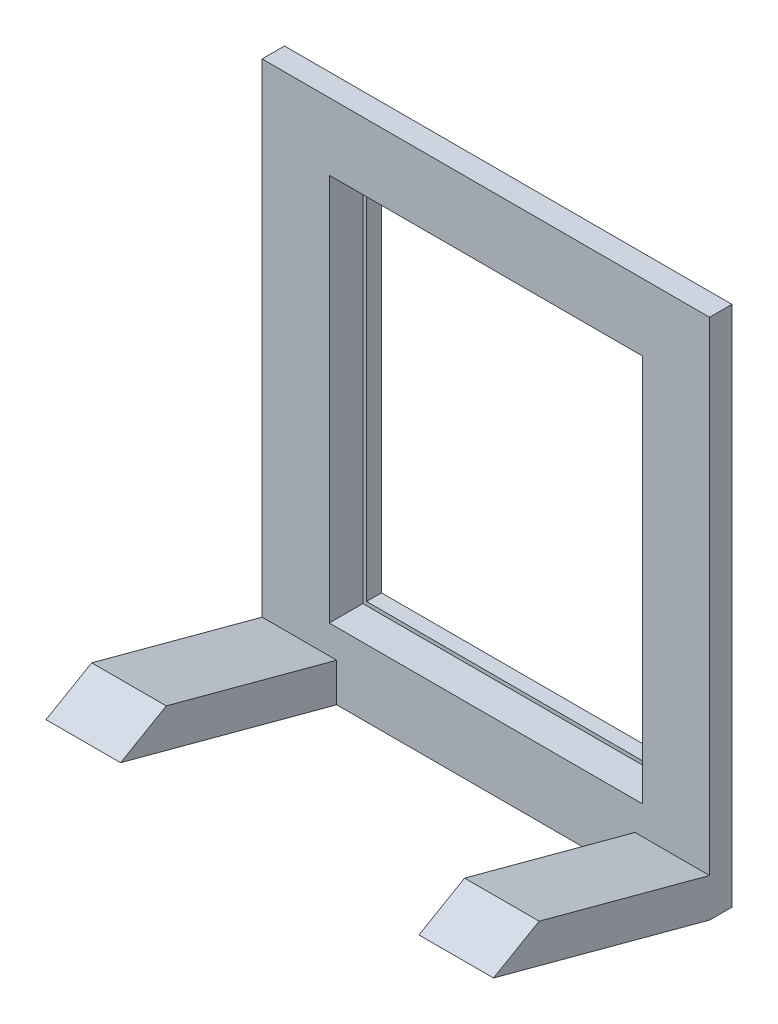
from build123d import *

# Parameters (mm, degrees)
EXTRUDE_1_DEPTH      = 4.5
EXTRUDE_1_DEPTH_BACK = 2
SKETCH_1_W           = 60
SKETCH_1_H           = 70
SKETCH_1_W_2         = 41
SKETCH_1_H_2         = 51
SKETCH_2_W           = 42
SKETCH_2_H           = 52
CUT_EXTRUDE_2_DEPTH  = 47.316843588
EXTRUDE_2_DEPTH      = 10


with BuildPart() as part:
    # Эскиз1 → Бобышка-Вытянуть1 (new, two sides: drawn at the far end of the back side and taken through both)
    with BuildSketch(Plane.XY.offset(-EXTRUDE_1_DEPTH_BACK)):
        Rectangle(SKETCH_1_W, SKETCH_1_H)
        Rectangle(SKETCH_1_W_2, SKETCH_1_H_2, mode=Mode.SUBTRACT)
    extrude(amount=EXTRUDE_1_DEPTH + EXTRUDE_1_DEPTH_BACK)

    # Эскиз2 → Вырез-Вытянуть2 (cut, through all)
    with BuildSketch(Plane(origin=(0, 0, 0), x_dir=(-1, 0, 0), z_dir=(0, 0, -1))):
        Rectangle(SKETCH_2_W, SKETCH_2_H)
    extrude(amount=-CUT_EXTRUDE_2_DEPTH, mode=Mode.SUBTRACT)

    # Вырез-По траектории1: sweep along a path in Эскиз4
    with BuildLine(Plane(origin=(0, 0, -2), x_dir=(-1, 0, 0), z_dir=(0, 0, -1))) as sweep_1_path:
        Line((-30, 35), (-30, -35))
        Line((-30, -35), (30, -35))
        Line((30, -35), (30, 35))
        Line((30, 35), (-30, 35))
    # Эскиз3 → Вырез-По траектории1 (sweep, cut)
    with BuildSketch(Plane(origin=(0, -35, 0), x_dir=(-1, 0, 0), z_dir=(0, -1, 0))):
        with BuildLine():
            Line((-30, 2), (-30, -1.5))
            Line((-30, -1.5), (-28.5, -1.5))
            Line((-28.5, -1.5), (-28.5, -2.5))
            Line((-28.5, -2.5), (-27, -2.5))
            Line((-27, -2.5), (-27, -2))
            ThreePointArc((-27, -2), (-25.297684645, 0.454165972), (-22.5, 1.5))
            Line((-22.5, 1.5), (-22, 1.5))
            Line((-22, 1.5), (-22, 2))
            Line((-22, 2), (-30, 2))
        make_face()
    sweep(path=sweep_1_path.line, transition=Transition.RIGHT, mode=Mode.SUBTRACT)

    # Эскиз5 → Бобышка-Вытянуть2 (add)
    with BuildSketch(Plane(origin=(30, 0, 0), x_dir=(0, 0, -1), z_dir=(1, 0, 0))):
        Polygon((-33.477774789, -27.235428647), (-4.5, -35), (-4.5, -29.823619098), (-27.354050432, -23.699894741), align=None)
    extrude_2 = extrude(amount=-EXTRUDE_2_DEPTH)

    # Зеркальное отражение1: Бобышка-Вытянуть2 across plane
    add(extrude_2.mirror(Plane(origin=(0, 0, 0), x_dir=(0, 0, 1), z_dir=(1, 0, 0))))


solid = part.part
